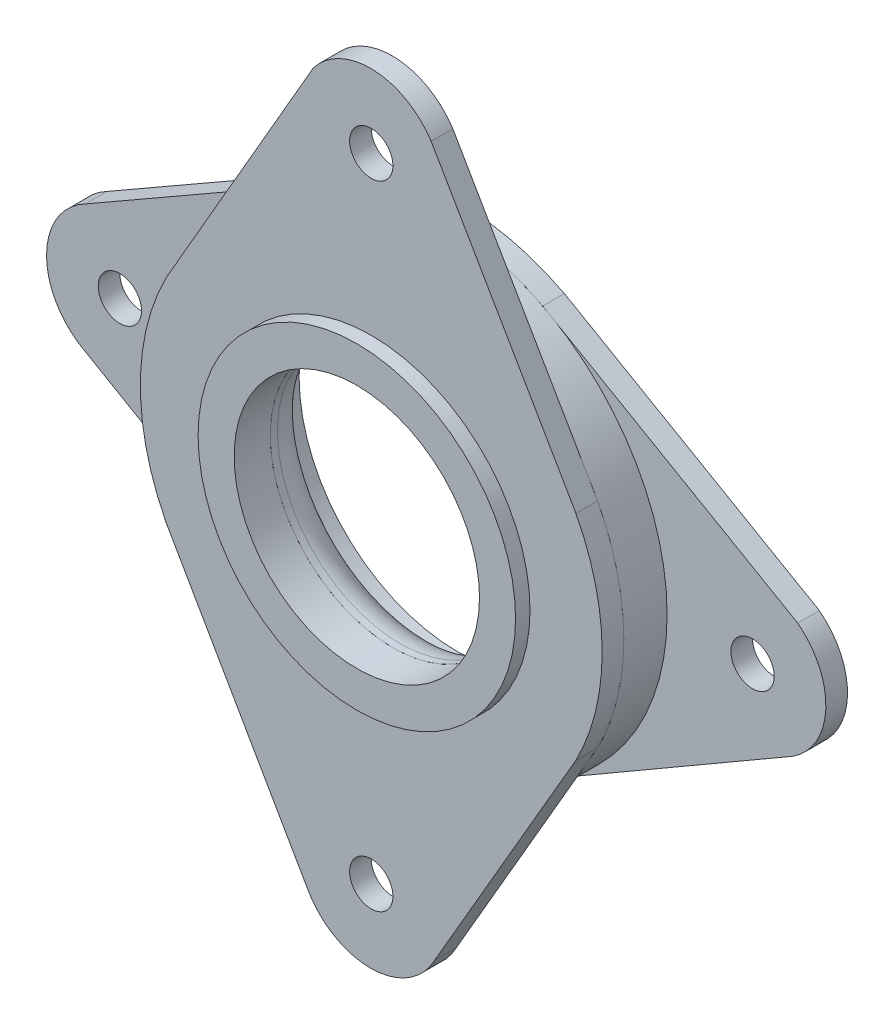
from build123d import *

# Parameters (mm, degrees)
BOSS_EXTRUDE1_DEPTH      = 1.5
SKETCH2_R                = 1.5
SKETCH2_R_2              = 8.5
CUT_EXTRUDE1_DEPTH       = 32.420495375
BODY_MOVE_COPY1_ANGLE    = 90
BOSS_EXTRUDE2_DEPTH      = 1.5
BOSS_EXTRUDE2_DEPTH_BACK = 1.5
SKETCH3_R                = 16
SKETCH3_R_2              = 8.5
SKETCH4_R                = 11
CUT_EXTRUDE2_DEPTH       = 1.5
FILLET1_R                = 2.5
SKETCH6_R                = 11
SKETCH6_R_2              = 8.5
BOSS_EXTRUDE4_DEPTH      = 1


with BuildPart() as part:
    # Sketch1 → Boss-Extrude1 (new body)
    with BuildSketch(Plane.XY):
        with BuildLine():
            Line((7.379381976, 14.196644732), (25.046611975, 4.009443432))
            ThreePointArc((25.046611975, 4.009443432), (26.995880172, -0.156936678), (24.716922459, -4.152524428))
            Line((24.716922459, -4.152524428), (7.407985651, -14.181739971))
            ThreePointArc((7.407985651, -14.181739971), (-0.010581597, -15.999996501), (-7.426737349, -14.171929027))
            Line((-7.426737349, -14.171929027), (-24.302900872, -4.393201109))
            ThreePointArc((-24.302900872, -4.393201109), (-26.99995272, 0.040951738), (-24.309846191, 4.479321596))
            Line((-24.309846191, 4.479321596), (-7.325019927, 14.224770053))
            ThreePointArc((-7.325019927, 14.224770053), (0.030603374, 15.999970732), (7.379381976, 14.196644732))
        make_face()
    extrude(amount=BOSS_EXTRUDE1_DEPTH)

    # Sketch2 → Cut-Extrude1 (cut, through all)
    with BuildSketch(Plane.XY.offset(1.5)):
        with Locations((-21.92, 0)):
            Circle(SKETCH2_R)
        with Locations((21.92, 0)):
            Circle(SKETCH2_R)
        Circle(SKETCH2_R_2)
    extrude(amount=-CUT_EXTRUDE1_DEPTH, mode=Mode.SUBTRACT)


with BuildPart() as body_2:
    # Mirror2: mirrored copy
    add(part.part.mirror(Plane.XY.offset(3)))


with BuildPart() as body_2_1:
    # Body-Move/Copy1: moved
    add(body_2.part.rotate(Axis((0, 0, 0), (0, 0, 1)), BODY_MOVE_COPY1_ANGLE))

    # Sketch6 → Boss-Extrude4 (add)
    with BuildSketch(Plane.XY.offset(6)):
        with Locations(Location((0, 0, 0), (0, 0, 180))):
            Circle(SKETCH6_R)
        Circle(SKETCH6_R_2, mode=Mode.SUBTRACT)
    extrude(amount=BOSS_EXTRUDE4_DEPTH)


with BuildPart() as body_3:
    # Sketch3 → Boss-Extrude2 (new, two sides: drawn at the far end of the back side and taken through both)
    with BuildSketch(Plane.XY.offset(3).offset(-BOSS_EXTRUDE2_DEPTH_BACK)):
        Circle(SKETCH3_R)
        Circle(SKETCH3_R_2, mode=Mode.SUBTRACT)
    extrude(amount=BOSS_EXTRUDE2_DEPTH + BOSS_EXTRUDE2_DEPTH_BACK)

    # Fillet1
    fillet1_edges = [body_3.edges().sort_by_distance(p)[0] for p in [
        (-8.5, 0, 1.5),
    ]]
    fillet(fillet1_edges, radius=FILLET1_R)


with BuildPart() as part_1:
    add(part.part)

    # Sketch4 → Cut-Extrude2 (cut)
    with BuildSketch(Plane(origin=(0, 0, 0), x_dir=(-1, 0, 0), z_dir=(0, 0, -1))):
        Circle(SKETCH4_R)
    extrude(amount=-CUT_EXTRUDE2_DEPTH, mode=Mode.SUBTRACT)


solid = Compound([body_2_1.part, body_3.part, part_1.part])
